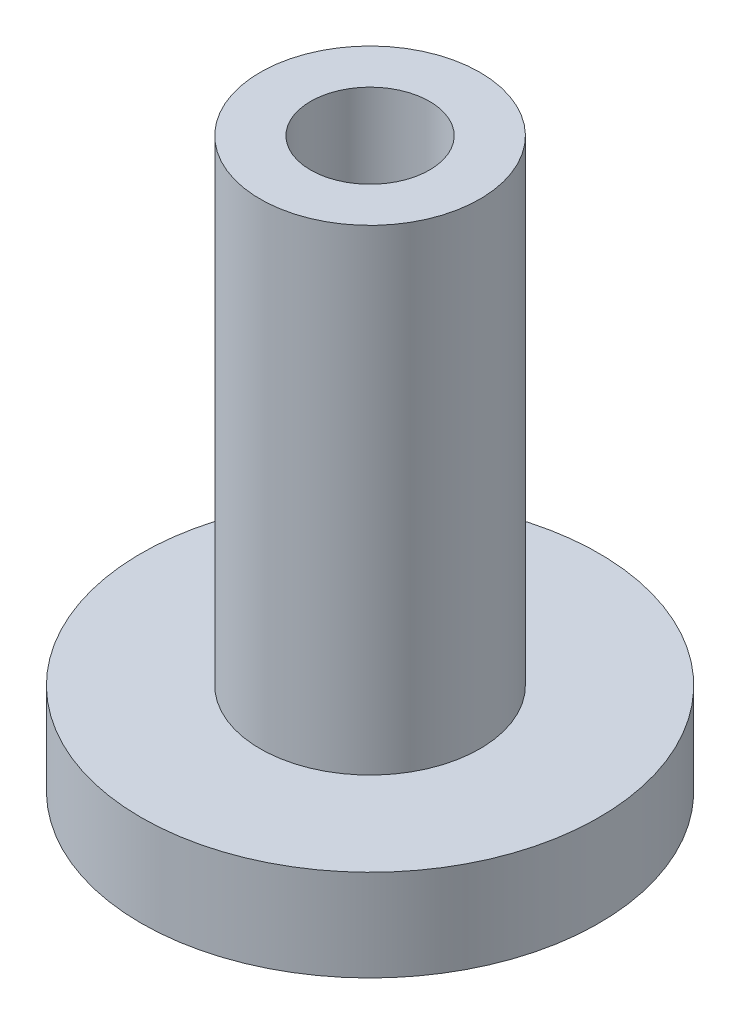
from build123d import *

# Parameters (mm, degrees)
SKETCH1_R           = 6.35
BOSS_EXTRUDE1_DEPTH = 2.54
SKETCH2_R           = 3.048
BOSS_EXTRUDE2_DEPTH = 13.208
SKETCH3_R           = 1.651
CUT_EXTRUDE1_DEPTH  = 19.128554934


with BuildPart() as part:
    # Sketch1 → Boss-Extrude1 (new body)
    with BuildSketch(Plane(origin=(0, 0, 0), x_dir=(1, 0, 0), z_dir=(0, 1, 0))):
        with Locations(Location((0, 0, 0), (0, 0, 270))):
            Circle(SKETCH1_R)
    extrude(amount=BOSS_EXTRUDE1_DEPTH)

    # Sketch2 → Boss-Extrude2 (add)
    with BuildSketch(Plane(origin=(0, 2.54, 0), x_dir=(1, 0, 0), z_dir=(0, 1, 0))):
        with Locations(Location((0, 0, 0), (0, 0, 90))):
            Circle(SKETCH2_R)
    extrude(amount=BOSS_EXTRUDE2_DEPTH)

    # Sketch3 → Cut-Extrude1 (cut, through all)
    with BuildSketch(Plane(origin=(0, 15.748, 0), x_dir=(1, 0, 0), z_dir=(0, 1, 0))):
        with Locations(Location((0, 0, 0), (0, 0, 270))):
            Circle(SKETCH3_R)
    extrude(amount=-CUT_EXTRUDE1_DEPTH, mode=Mode.SUBTRACT)


solid = part.part
